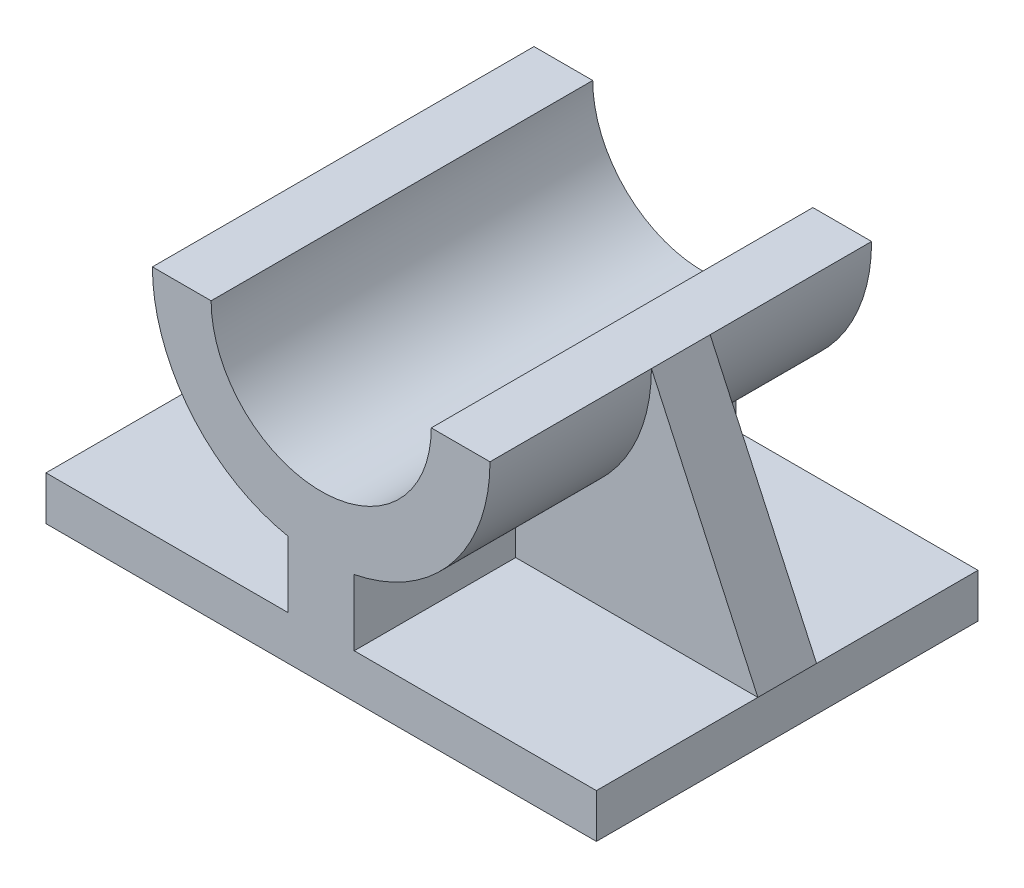
from build123d import *

# Parameters (mm, degrees)
BOSS_EXTRUDE1_DEPTH = 26
RIB1_REACH          = 61.099
SKETCH2_WALL_W      = 154.925032954
SKETCH2_WALL_H      = 8


with BuildPart() as part:
    # Sketch1 → Boss-Extrude1 (new, symmetric)
    with BuildSketch(Plane.XY):
        with BuildLine():
            Line((-37.5, -37.555487137), (0, -37.555487137))
            Line((0, -37.555487137), (0, -15))
            ThreePointArc((0, -15), (-10.606601718, -10.606601718), (-15, 0))
            Line((-15, 0), (-23, 0))
            ThreePointArc((-23, 0), (-17.783419244, -14.585952146), (-4.5, -22.555487137))
            Line((-4.5, -22.555487137), (-4.5, -31.555487137))
            Line((-4.5, -31.555487137), (-37.5, -31.555487137))
            Line((-37.5, -31.555487137), (-37.5, -37.555487137))
        make_face()
        with BuildLine():
            Line((0, -37.555487137), (37.5, -37.555487137))
            Line((37.5, -37.555487137), (37.5, -31.555487137))
            Line((37.5, -31.555487137), (4.5, -31.555487137))
            Line((4.5, -31.555487137), (4.5, -22.555487137))
            ThreePointArc((4.5, -22.555487137), (17.783419244, -14.585952146), (23, 0))
            Line((23, 0), (15, 0))
            ThreePointArc((15, 0), (10.606601718, -10.606601718), (0, -15))
            Line((0, -15), (0, -37.555487137))
        make_face()
    extrude(amount=BOSS_EXTRUDE1_DEPTH, both=True)

    # Sketch2 wall → Rib1 (add, up to next)
    with BuildSketch(Plane(origin=(30.25, -15.777743569, 0), x_dir=(0.417536618888, -0.908660097004, 0), z_dir=(0.908660097004, 0.417536618888, 0)), mode=Mode.PRIVATE) as rib1_sk1:
        Rectangle(SKETCH2_WALL_W, SKETCH2_WALL_H)
    rib1_tool1 = extrude(rib1_sk1.sketch, amount=-RIB1_REACH, mode=Mode.PRIVATE) - part.part
    rib1 = rib1_tool1.solids().sort_by_distance((30.25, -15.777743569, 0))[0]
    add(rib1)

    # Mirror1: Rib1 across plane
    add(rib1.mirror(Plane(origin=(0, 0, 0), x_dir=(0, 0, 1), z_dir=(1, 0, 0))))


solid = part.part
